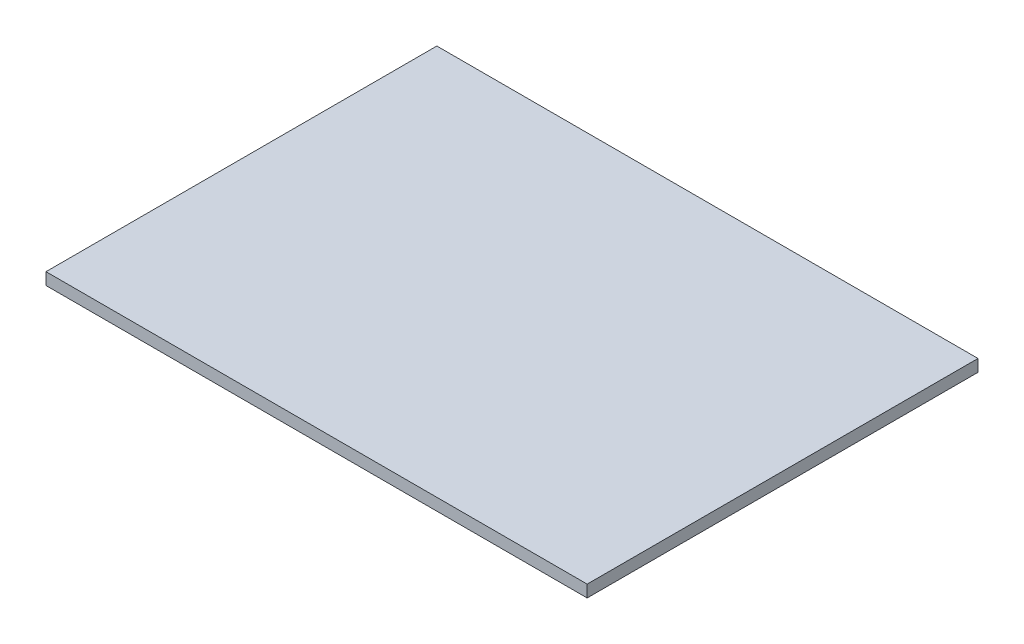
from build123d import *

# Parameters (mm, degrees)
SKETCH1_W           = 90
SKETCH1_H           = 65
BOSS_EXTRUDE1_DEPTH = 2


with BuildPart() as part:
    # Sketch1 → Boss-Extrude1 (new body)
    with BuildSketch(Plane(origin=(0, 0, 0), x_dir=(1, 0, 0), z_dir=(0, 1, 0))):
        with Locations((45, 32.5)):
            Rectangle(SKETCH1_W, SKETCH1_H)
    extrude(amount=BOSS_EXTRUDE1_DEPTH)


solid = part.part
